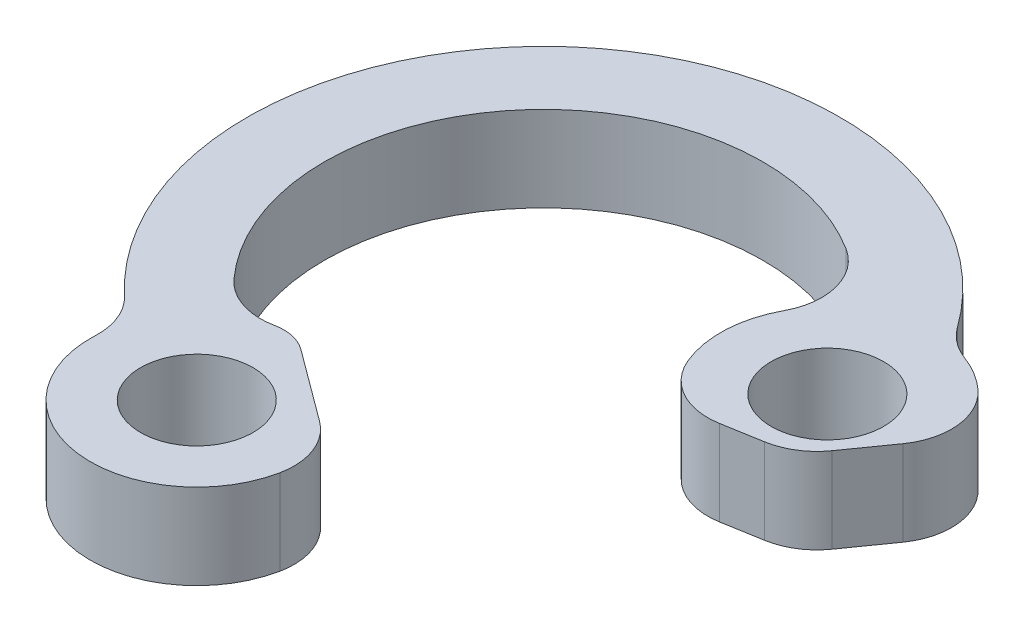
from build123d import *

# Parameters (mm, degrees)
SKETCH1_R           = 2.6375
BOSS_EXTRUDE1_DEPTH = 4


with BuildPart() as part:
    # Sketch1 → Boss-Extrude1 (new body)
    with BuildSketch(Plane(origin=(0, 4, 0), x_dir=(1, 0, 0), z_dir=(0, 1, 0))):
        with BuildLine():
            Line((85.735483712, 77.323980784), (87.547228424, 77.6361992))
            ThreePointArc((87.547228424, 77.6361992), (88.638512401, 78.055387782), (89.486725608, 78.859846695))
            Line((89.486725608, 78.859846695), (90.859907816, 80.800603382))
            ThreePointArc((90.859907816, 80.800603382), (91.392372444, 82.866543385), (90.417013283, 84.763989347))
            ThreePointArc((90.417013283, 84.763989347), (89.660091993, 85.325292733), (88.8112973, 85.73460789))
            ThreePointArc((88.8112973, 85.73460789), (88.035402119, 86.161615284), (87.417993221, 86.796560083))
            ThreePointArc((87.417993221, 86.796560083), (66.977031359, 89.139944323), (66.603972706, 68.568478678))
            ThreePointArc((66.603972706, 68.568478678), (67.327519051, 67.51101449), (67.543844855, 66.248100016))
            ThreePointArc((67.543844855, 66.248100016), (71.92413831, 61.058265048), (77.438126505, 65.022769043))
            ThreePointArc((77.438126505, 65.022769043), (77.298986696, 66.69694337), (76.281652818, 68.033824571))
            Line((76.281652818, 68.033824571), (72.915652336, 70.521815026))
            ThreePointArc((72.915652336, 70.521815026), (72.158360379, 70.866374525), (71.326393596, 70.872979652))
            ThreePointArc((71.326393596, 70.872979652), (69.787994238, 70.962547772), (68.497017033, 71.804018441))
            ThreePointArc((68.497017033, 71.804018441), (68.277664092, 85.314017723), (81.632240885, 87.369127207))
            ThreePointArc((81.632240885, 87.369127207), (82.929152896, 85.595651679), (82.669646853, 83.413942984))
            ThreePointArc((82.669646853, 83.413942984), (82.079827473, 81.296958117), (82.454695982, 79.131551589))
            ThreePointArc((82.454695982, 79.131551589), (83.778317702, 77.652816556), (85.735483712, 77.323980784))
        make_face()
        with Locations(Location((72.538655529, 66.020358214, 0), (0, 0, 90))):
            Circle(SKETCH1_R, mode=Mode.SUBTRACT)
        with Locations(Location((87.073540725, 81.04630307, 0), (0, 0, 90))):
            Circle(SKETCH1_R, mode=Mode.SUBTRACT)
    extrude(amount=-BOSS_EXTRUDE1_DEPTH)


solid = part.part
